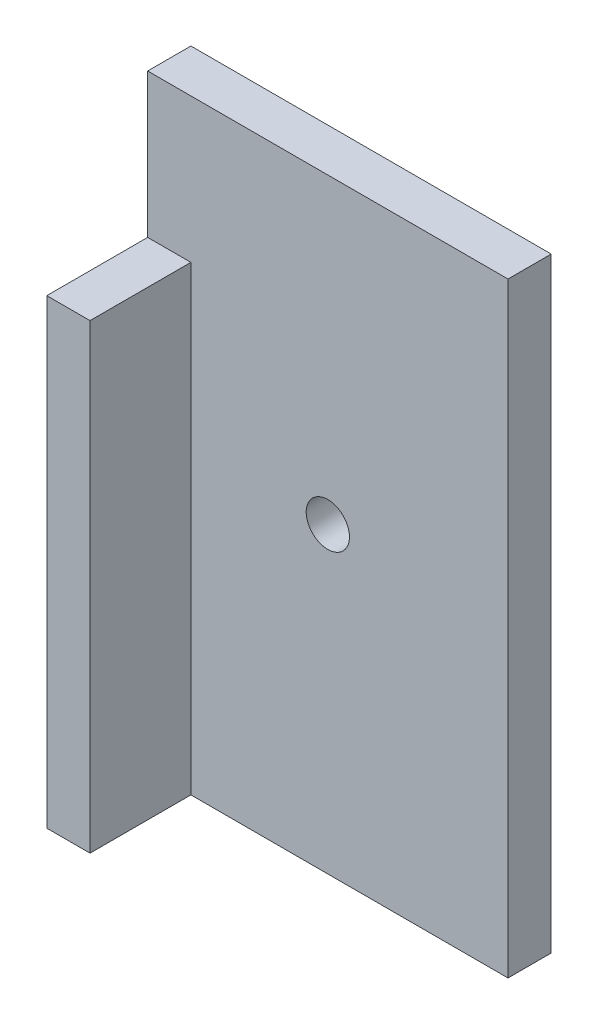
from build123d import *

# Parameters (mm, degrees)
SKETCH_1_W          = 25
SKETCH_1_H          = 42
SKETCH_1_R          = 1.5
EXTRUDE_1_DEPTH     = 3
SKETCH_2_W          = 3
SKETCH_2_H          = 42
EXTRUDE_2_DEPTH     = 7
SKETCH_4_W          = 7
SKETCH_4_H          = 10
CUT_EXTRUDE_1_DEPTH = 10


with BuildPart() as part:
    # 草图1 → 凸台-拉伸1 (new body)
    with BuildSketch(Plane.XY):
        Rectangle(SKETCH_1_W, SKETCH_1_H)
        Circle(SKETCH_1_R, mode=Mode.SUBTRACT)
    extrude(amount=EXTRUDE_1_DEPTH)

    # 草图2 → 凸台-拉伸2 (add)
    with BuildSketch(Plane.XY.offset(3)):
        with Locations((-11, 0)):
            Rectangle(SKETCH_2_W, SKETCH_2_H)
    extrude(amount=EXTRUDE_2_DEPTH)

    # 草图4 → 切除-拉伸1 (cut)
    with BuildSketch(Plane(origin=(-9.5, 0, 0), x_dir=(0, 0, -1), z_dir=(1, 0, 0))):
        with Locations((-6.5, 16)):
            Rectangle(SKETCH_4_W, SKETCH_4_H)
    extrude(amount=-CUT_EXTRUDE_1_DEPTH, mode=Mode.SUBTRACT)


solid = part.part
